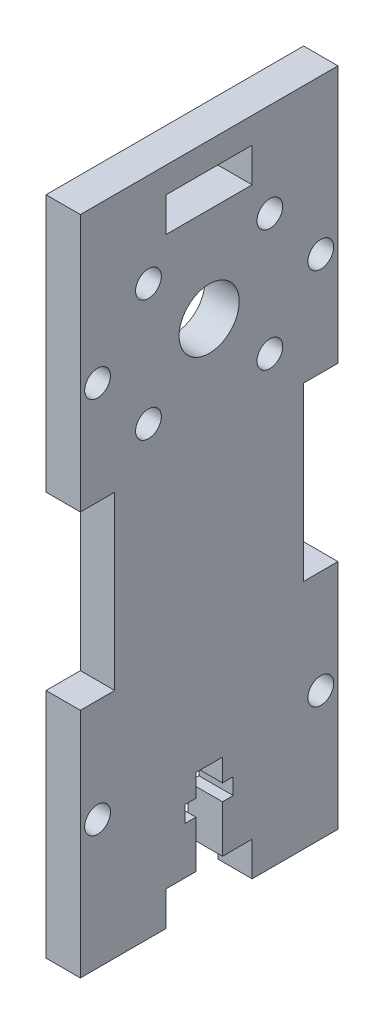
from build123d import *

# Parameters (mm, degrees)
SKETCH1_R           = 1.5
BOSS_EXTRUDE1_DEPTH = 4
SKETCH2_R           = 3.5
SKETCH2_R_2         = 1.5
CUT_EXTRUDE1_DEPTH  = 4
SKETCH3_W           = 4
SKETCH3_H           = 30
BOSS_EXTRUDE2_DEPTH = 3
SKETCH5_W           = 1.55
SKETCH5_H           = 2.6
SKETCH5_H_2         = 1.9
SKETCH5_H_3         = 5.5
SKETCH5_W_2         = 1.25
CUT_EXTRUDE2_DEPTH  = 10


with BuildPart() as part:
    # Sketch1 → Boss-Extrude1 (new body)
    with BuildSketch(Plane(origin=(0, 0, 0), x_dir=(0, 0, -1), z_dir=(1, 0, 0))):
        Polygon((30, 74), (20, 74), (20, 70), (10, 70), (10, 74), (0, 74), (0, 47), (4, 47), (4, 27), (0, 27), (0, 0), (10, 0), (10, 4), (20, 4), (20, 0), (30, 0), (30, 27), (26, 27), (26, 47), (30, 47), align=None)
        with Locations((2, 15)):
            Circle(SKETCH1_R, mode=Mode.SUBTRACT)
        with Locations((28, 15)):
            Circle(SKETCH1_R, mode=Mode.SUBTRACT)
        with Locations((2, 59)):
            Circle(SKETCH1_R, mode=Mode.SUBTRACT)
        with Locations((28, 59)):
            Circle(SKETCH1_R, mode=Mode.SUBTRACT)
    extrude(amount=BOSS_EXTRUDE1_DEPTH)

    # Sketch2 → Cut-Extrude1 (cut)
    with BuildSketch(Plane(origin=(4, 0, 0), x_dir=(0, 0, -1), z_dir=(1, 0, 0))):
        with Locations((15, 59)):
            Circle(SKETCH2_R)
        with Locations((7.928932188, 66.071067812)):
            Circle(SKETCH2_R_2)
        with Locations((22.071067812, 66.071067812)):
            Circle(SKETCH2_R_2)
        with Locations((22.071067812, 51.928932188)):
            Circle(SKETCH2_R_2)
        with Locations((7.928932188, 51.928932188)):
            Circle(SKETCH2_R_2)
    extrude(amount=-CUT_EXTRUDE1_DEPTH, mode=Mode.SUBTRACT)

    # Sketch3 → Boss-Extrude2 (add)
    with BuildSketch(Plane(origin=(0, 74, 0), x_dir=(1, 0, 0), z_dir=(0, 1, 0))):
        with Locations((2, 15)):
            Rectangle(SKETCH3_W, SKETCH3_H)
    extrude(amount=BOSS_EXTRUDE2_DEPTH)

    # Sketch5 → Cut-Extrude2 (cut)
    with BuildSketch(Plane(origin=(4, 0, 0), x_dir=(0, 0, -1), z_dir=(1, 0, 0))):
        with Locations((14.225, 12.7)):
            Rectangle(SKETCH5_W, SKETCH5_H)
        with Locations((14.225, 10.45)):
            Rectangle(SKETCH5_W, SKETCH5_H_2)
        with Locations((14.225, 6.75)):
            Rectangle(SKETCH5_W, SKETCH5_H_3)
        with Locations((15.775, 12.7)):
            Rectangle(SKETCH5_W, SKETCH5_H)
        with Locations((15.775, 10.45)):
            Rectangle(SKETCH5_W, SKETCH5_H_2)
        with Locations((15.775, 6.75)):
            Rectangle(SKETCH5_W, SKETCH5_H_3)
        with Locations((17.175, 10.45)):
            Rectangle(SKETCH5_W_2, SKETCH5_H_2)
        with Locations((12.825, 10.45)):
            Rectangle(SKETCH5_W_2, SKETCH5_H_2)
    extrude(amount=-CUT_EXTRUDE2_DEPTH, mode=Mode.SUBTRACT)


solid = part.part
